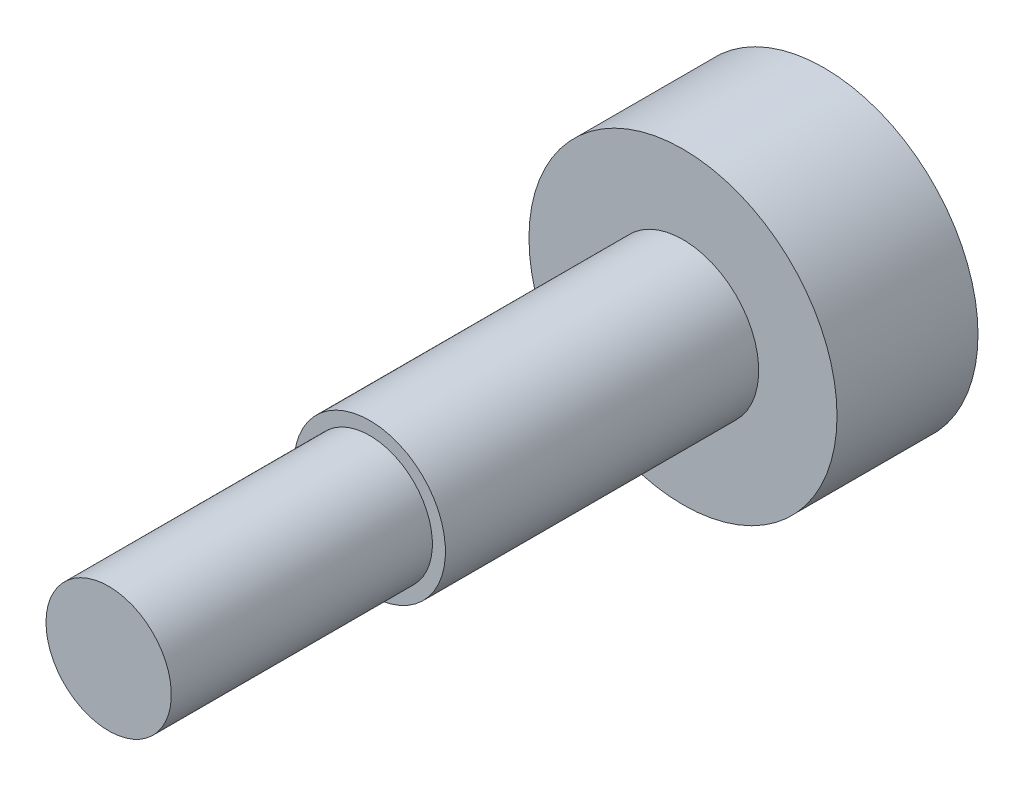
from build123d import *

# Parameters (mm, degrees)
SKETCH_1_W = 1.2
SKETCH_1_H = 5


with BuildPart() as part:
    # 草图1 → 旋转1 (revolve)
    with BuildSketch(Plane(origin=(0, 0, 0), x_dir=(1, 0, 0), z_dir=(0, 1, 0)), mode=Mode.PRIVATE) as revolve_1_sk:
        Polygon((0, 8.7), (0, 6), (1.45, 6), (2.95, 6), (2.95, 8.7), align=None)
        Polygon((0, 6), (0, 0), (1.2, 0), (1.45, 0), (1.45, 6), align=None)
        with Locations((0.6, -2.5)):
            Rectangle(SKETCH_1_W, SKETCH_1_H)
    revolve(revolve_1_sk.sketch.rotate(Axis((0, 0, -34.43030142), (0, 0, 1)), 180), axis=Axis((0, 0, -34.43030142), (0, 0, 1)))


solid = part.part
